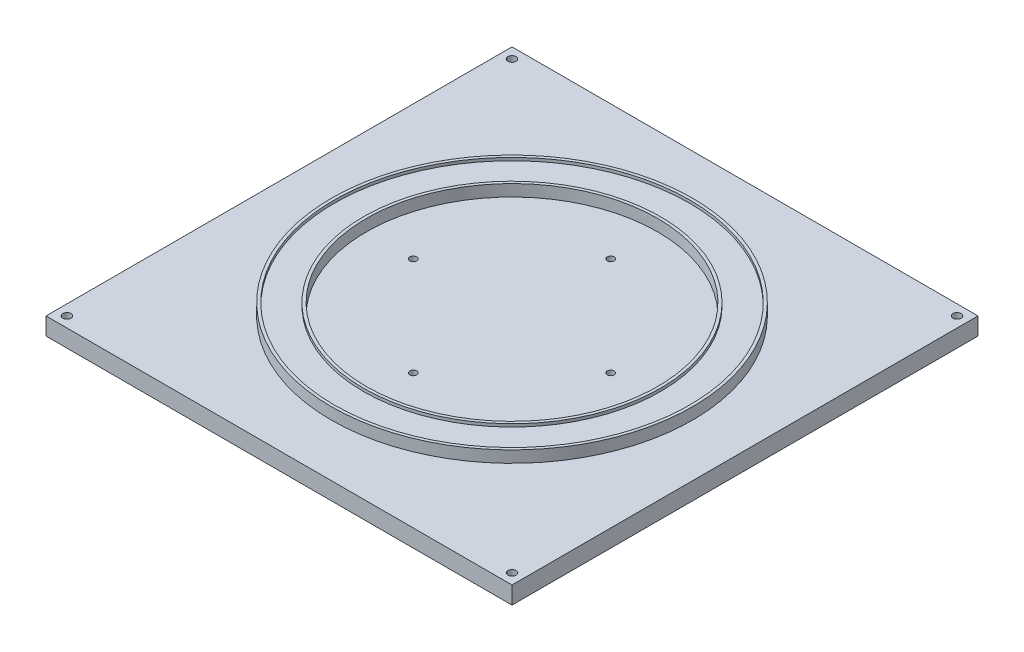
from build123d import *

# Parameters (mm, degrees)
SKETCH1_W           = 800
SKETCH1_H           = 800
BOSS_EXTRUDE1_DEPTH = 15
SKETCH4_R           = 6
CUT_EXTRUDE3_DEPTH  = 567.480361531
SKETCH3_R           = 310
SKETCH3_R_2         = 250
BOSS_EXTRUDE2_DEPTH = 20
SKETCH5_R           = 305
SKETCH5_R_2         = 255
CUT_EXTRUDE4_DEPTH  = 5
SKETCH6_R           = 7
CUT_EXTRUDE5_DEPTH  = 567.480361531


with BuildPart() as part:
    # Sketch1 → Boss-Extrude1 (new, symmetric)
    with BuildSketch(Plane(origin=(0, 0, 0), x_dir=(1, 0, 0), z_dir=(0, 1, 0))):
        Rectangle(SKETCH1_W, SKETCH1_H)
    extrude(amount=BOSS_EXTRUDE1_DEPTH, both=True)

    # Sketch4 → Cut-Extrude3 (cut, through all)
    with BuildSketch(Plane(origin=(0, 15, 0), x_dir=(1, 0, 0), z_dir=(0, 1, 0))):
        with Locations(Location((0, 169.5, 0), (0, 0, 270))):
            Circle(SKETCH4_R)
        with Locations(Location((169.5, 0, 0), (0, 0, 270))):
            Circle(SKETCH4_R)
        with Locations(Location((0, -169.5, 0), (0, 0, 90))):
            Circle(SKETCH4_R)
        with Locations(Location((-169.5, 0, 0), (0, 0, 90))):
            Circle(SKETCH4_R)
    extrude(amount=-CUT_EXTRUDE3_DEPTH, mode=Mode.SUBTRACT)

    # Sketch3 → Boss-Extrude2 (add)
    with BuildSketch(Plane(origin=(0, 15, 0), x_dir=(1, 0, 0), z_dir=(0, 1, 0))):
        with Locations(Location((0, 0, 0), (0, 0, 270))):
            Circle(SKETCH3_R)
        with Locations(Location((0, 0, 0), (0, 0, 270))):
            Circle(SKETCH3_R_2, mode=Mode.SUBTRACT)
    extrude(amount=BOSS_EXTRUDE2_DEPTH)

    # Sketch5 → Cut-Extrude4 (cut)
    with BuildSketch(Plane(origin=(0, 35, 0), x_dir=(1, 0, 0), z_dir=(0, 1, 0))):
        with Locations(Location((0, 0, 0), (0, 0, 270))):
            Circle(SKETCH5_R)
        with Locations(Location((0, 0, 0), (0, 0, 270))):
            Circle(SKETCH5_R_2, mode=Mode.SUBTRACT)
    extrude(amount=-CUT_EXTRUDE4_DEPTH, mode=Mode.SUBTRACT)

    # Sketch6 → Cut-Extrude5 (cut, through all)
    with BuildSketch(Plane(origin=(0, 15, 0), x_dir=(1, 0, 0), z_dir=(0, 1, 0))):
        with Locations(Location((-382, 382, 0), (0, 0, 270))):
            Circle(SKETCH6_R)
        with Locations(Location((382, 382, 0), (0, 0, 90))):
            Circle(SKETCH6_R)
        with Locations(Location((382, -382, 0), (0, 0, 270))):
            Circle(SKETCH6_R)
        with Locations(Location((-382, -382, 0), (0, 0, 90))):
            Circle(SKETCH6_R)
    extrude(amount=-CUT_EXTRUDE5_DEPTH, mode=Mode.SUBTRACT)


solid = part.part
